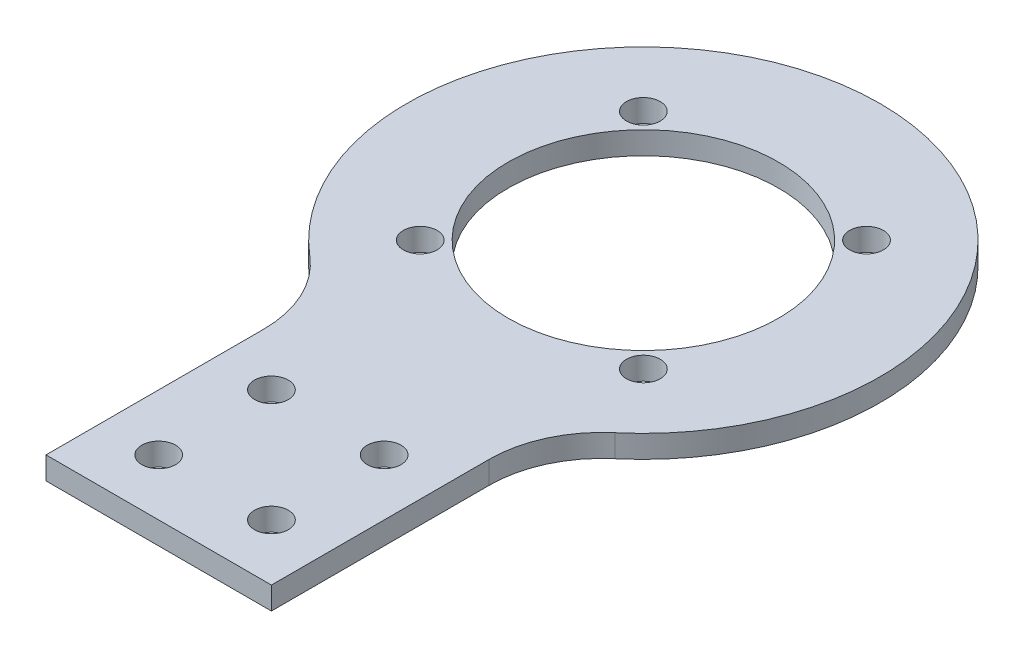
from build123d import *

# Parameters (mm, degrees)
SKETCH_2_R      = 21
SKETCH_2_R_2    = 12
SKETCH_2_R_3    = 1.5
EXTRUDE_1_DEPTH = 2
SKETCH_4_W      = 20
SKETCH_4_H      = 25
SKETCH_4_R      = 1.5
EXTRUDE_2_DEPTH = 2
FILLET_1_R      = 10


with BuildPart() as part:
    # 草图2 → 凸台-拉伸1 (new body)
    with BuildSketch(Plane(origin=(0, 0, 0), x_dir=(1, 0, 0), z_dir=(0, 1, 0))):
        with Locations(Location((0, 0, 0), (0, 0, 270))):
            Circle(SKETCH_2_R)
        with Locations(Location((0, 0, 0), (0, 0, 270))):
            Circle(SKETCH_2_R_2, mode=Mode.SUBTRACT)
        with Locations(Location((9.899494937, 9.899494937, 0), (0, 0, 270))):
            Circle(SKETCH_2_R_3, mode=Mode.SUBTRACT)
        with Locations(Location((9.899494937, -9.899494937, 0), (0, 0, 270))):
            Circle(SKETCH_2_R_3, mode=Mode.SUBTRACT)
        with Locations(Location((-9.899494937, -9.899494937, 0), (0, 0, 270))):
            Circle(SKETCH_2_R_3, mode=Mode.SUBTRACT)
        with Locations(Location((-9.899494937, 9.899494937, 0), (0, 0, 270))):
            Circle(SKETCH_2_R_3, mode=Mode.SUBTRACT)
    extrude(amount=EXTRUDE_1_DEPTH)

    # 草图4 → 凸台-拉伸2 (add)
    with BuildSketch(Plane(origin=(0, 2, 0), x_dir=(1, 0, 0), z_dir=(0, 1, 0))):
        with Locations((0, -30.5)):
            Rectangle(SKETCH_4_W, SKETCH_4_H)
        with Locations(Location((-5, -38, 0), (0, 0, 270))):
            Circle(SKETCH_4_R, mode=Mode.SUBTRACT)
        with Locations(Location((5, -38, 0), (0, 0, 270))):
            Circle(SKETCH_4_R, mode=Mode.SUBTRACT)
        with Locations(Location((-5, -28, 0), (0, 0, 270))):
            Circle(SKETCH_4_R, mode=Mode.SUBTRACT)
        with Locations(Location((5, -28, 0), (0, 0, 270))):
            Circle(SKETCH_4_R, mode=Mode.SUBTRACT)
    extrude(amount=-EXTRUDE_2_DEPTH)

    # 圆角1
    fillet_1_edges = [part.edges().sort_by_distance(p)[0] for p in [
        (-10, 1, 18.466185313),
        (10, 1, 18.466185313),
    ]]
    fillet(fillet_1_edges, radius=FILLET_1_R)


solid = part.part
